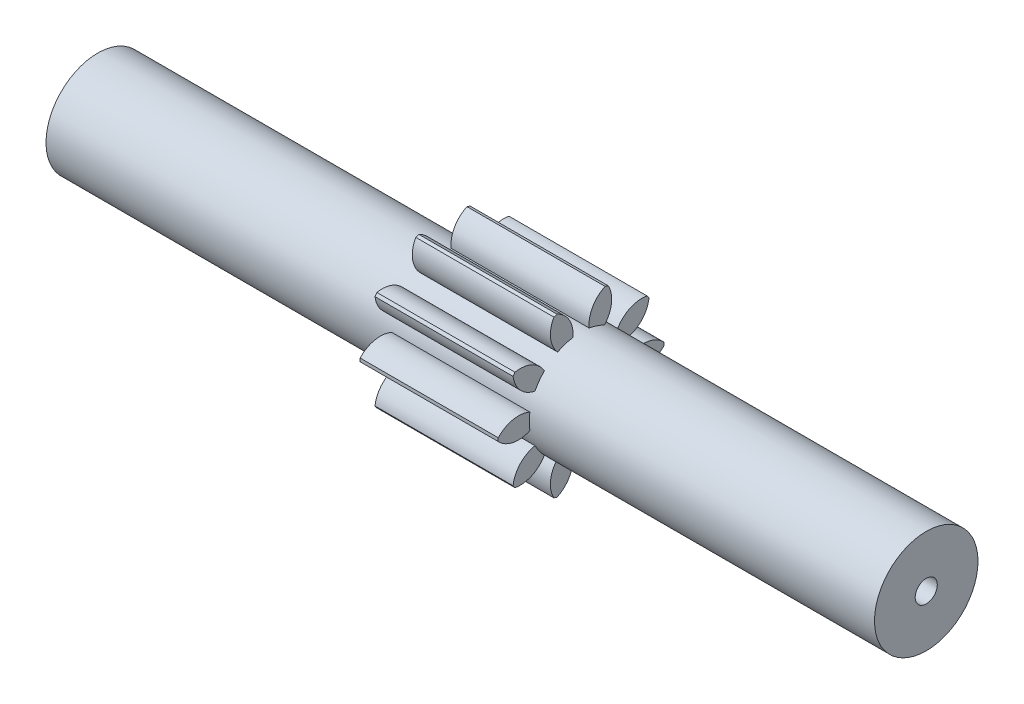
from build123d import *
from build123d.topology import SkipClean

# Parameters (mm, degrees)
BASPROSKE_W       = 5
BASPROSKE_H       = 3
TOOTHCUT_DEPTH    = 7.557438524
TEETHCUTS_COUNT   = 10
TEETHCUTS_ANGLE   = 324
HUBNEARBOTH_START = 12.5000254
HUBNEABOTSKE_R    = 1.874
HUBNEARBOTH_DEPTH = 12.5000254
HUBFARSKE_R       = 1.874
HUBFAR_DEPTH      = 12.5000254
BORSKE_R          = 0.4
BORE_DEPTH        = 30.0000508


with BuildPart() as part:
    # BasProSke → Base-Revolve (revolve)
    with BuildSketch(Plane(origin=(0, 0, 0), x_dir=(1, 0, 0), z_dir=(0, 1, 0)), mode=Mode.PRIVATE) as base_revolve_sk:
        with Locations((2.5, 1.5)):
            Rectangle(BASPROSKE_W, BASPROSKE_H)
    revolve(base_revolve_sk.sketch.rotate(Axis((-10, 0, 0), (1, 0, 0)), 180), axis=Axis((-10, 0, 0), (1, 0, 0)))

    # TooCutSke → ToothCut (cut, through all)
    with BuildSketch(Plane(origin=(0, 0, 0), x_dir=(0, 0, -1), z_dir=(1, 0, 0))):
        with BuildLine():
            ThreePointArc((0.296449938, 1.850403587), (0, 1.874), (-0.296449938, 1.850403587))
            ThreePointArc((-0.296449938, 1.850403587), (-0.428089565, 2.470295585), (-0.905889751, 2.886591228))
            ThreePointArc((-0.905889751, 2.886591228), (0, 3.0254), (0.905889751, 2.886591228))
            ThreePointArc((0.905889751, 2.886591228), (0.428089565, 2.470295585), (0.296449938, 1.850403587))
        make_face()
    toothcut = extrude(amount=TOOTHCUT_DEPTH, mode=Mode.SUBTRACT)

    # TeethCuts: ToothCut ×10 about axis
    teethcuts_axis = Axis((-10, 0, 0), (1, 0, 0))
    for i in range(1, TEETHCUTS_COUNT):
        add(toothcut.rotate(teethcuts_axis, i * TEETHCUTS_ANGLE / (TEETHCUTS_COUNT - 1)), mode=Mode.SUBTRACT)

    # HubNeaBotSke → HubNearBoth (add)
    with SkipClean():  # the faces are left unmerged after this step: merging them gives an invalid solid
        with BuildSketch(Plane.ZY.offset(HUBNEARBOTH_START)):
            Circle(HUBNEABOTSKE_R)
        extrude(amount=-HUBNEARBOTH_DEPTH)

    # HubFarSke → HubFar (add)
    with SkipClean():  # the faces are left unmerged after this step: merging them gives an invalid solid
        with BuildSketch(Plane(origin=(5, 0, 0), x_dir=(0, 0, -1), z_dir=(1, 0, 0))):
            with Locations(Location((0, 0, 0), (0, 0, 180))):
                Circle(HUBFARSKE_R)
        extrude(amount=HUBFAR_DEPTH)

    # BorSke → Bore (cut, symmetric)
    with SkipClean():  # the faces are left unmerged after this step: merging them gives an invalid solid
        with BuildSketch(Plane(origin=(0, 0, 0), x_dir=(0, 0, -1), z_dir=(1, 0, 0))):
            with Locations(Location((0, 0, 0), (0, 0, 180))):
                Circle(BORSKE_R)
        extrude(amount=BORE_DEPTH, both=True, mode=Mode.SUBTRACT)


solid = part.part
